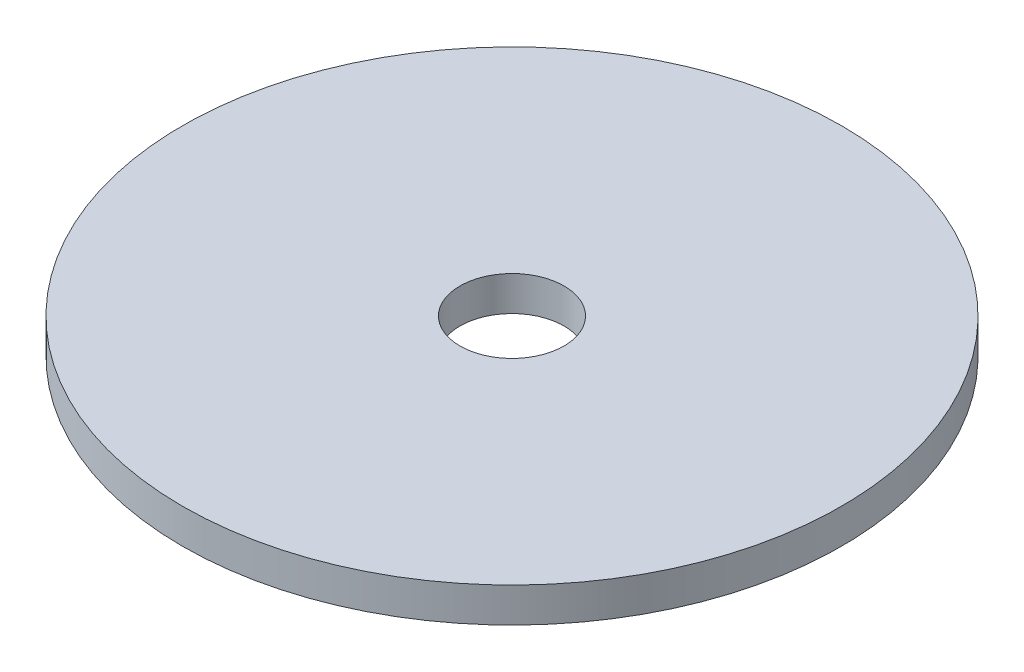
from build123d import *

# Parameters (mm, degrees)
SKETCH2_R           = 4.75
SKETCH2_R_2         = 0.75
BOSS_EXTRUDE1_DEPTH = 0.5


with BuildPart() as part:
    # Sketch2 → Boss-Extrude1 (new body)
    with BuildSketch(Plane(origin=(0, 0, 0), x_dir=(1, 0, 0), z_dir=(0, 1, 0))):
        with Locations(Location((0, 0, 0), (0, 0, 270))):
            Circle(SKETCH2_R)
        with Locations(Location((0, 0, 0), (0, 0, 270))):
            Circle(SKETCH2_R_2, mode=Mode.SUBTRACT)
    extrude(amount=-BOSS_EXTRUDE1_DEPTH)


solid = part.part
